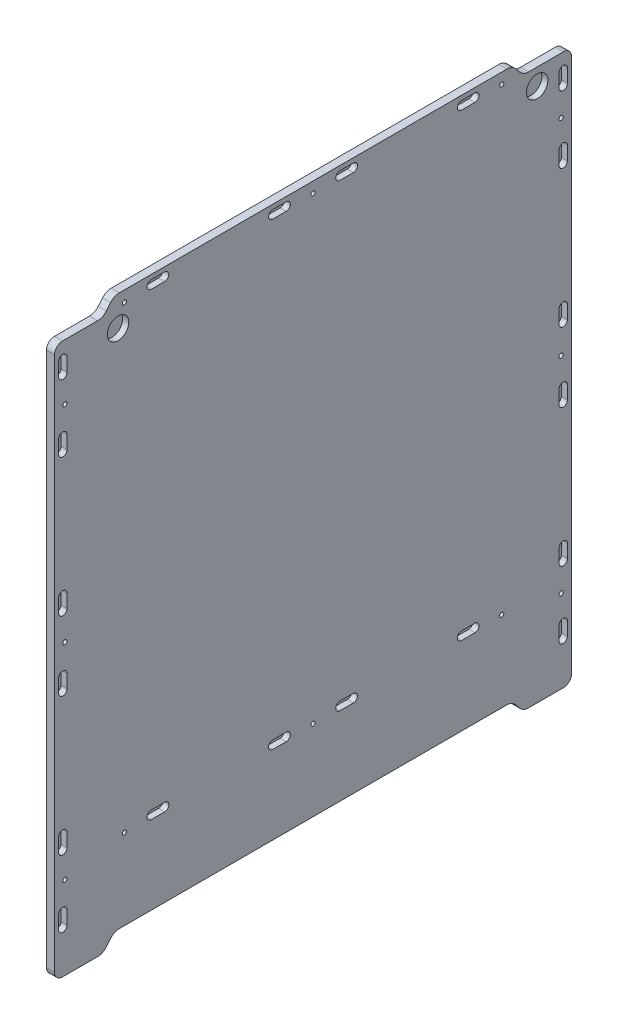
from build123d import *

# Parameters (mm, degrees)
CROQUIS1_R              = 4.25
CROQUIS1_R_2            = 1.55
CROQUIS1_R_3            = 1.6
SALIENTE_EXTRUIR1_DEPTH = 6
CROQUIS3_R              = 8
CORTAR_EXTRUIR1_DEPTH   = 4.5
CHAFL_N1_SIZE           = 1.5
CROQUIS4_W              = 11.100184954
CROQUIS4_H              = 11.272280845
CROQUIS4_W_2            = 11.999327681
SALIENTE_EXTRUIR2_DEPTH = 1.5


with BuildPart() as part:
    # Croquis1 → Saliente-Extruir1 (new body)
    with BuildSketch(Plane(origin=(0, 0, 0), x_dir=(0, 0, -1), z_dir=(1, 0, 0))):
        with BuildLine():
            Line((138.549019323, -203.054493985), (135.2532588, -199.126759542))
            ThreePointArc((135.2532588, -199.126759542), (132.334136258, -196.886838034), (128.741881033, -196.090454224))
            Line((128.741881033, -196.090454224), (-159.54831728, -196.090454224))
            ThreePointArc((-159.54831728, -196.090454224), (-163.140572505, -196.886838034), (-166.059695047, -199.126759542))
            Line((-166.059695047, -199.126759542), (-169.355455569, -203.054493985))
            ThreePointArc((-169.355455569, -203.054493985), (-172.274578058, -205.294415452), (-175.866833217, -206.090799248))
            Line((-175.866833217, -206.090799248), (-201.903218123, -206.090799248))
            ThreePointArc((-201.903218123, -206.090799248), (-206.14585881, -204.333439935), (-207.903218123, -200.090799248))
            Line((-207.903218123, -200.090799248), (-207.903218123, 198.006904316))
            ThreePointArc((-207.903218123, 198.006904316), (-206.14585881, 202.249545003), (-201.903218123, 204.006904316))
            Line((-201.903218123, 204.006904316), (-175.90321816, 204.006904316))
            ThreePointArc((-175.90321816, 204.006904316), (-172.310962954, 204.803288122), (-169.391840427, 207.043209618))
            Line((-169.391840427, 207.043209618), (-166.178352388, 210.872895533))
            ThreePointArc((-166.178352388, 210.872895533), (-163.259229941, 213.112816968), (-159.666974833, 213.909200752))
            Line((-159.666974833, 213.909200752), (128.860538587, 213.909200752))
            ThreePointArc((128.860538587, 213.909200752), (132.452793695, 213.112816968), (135.371916141, 210.872895533))
            Line((135.371916141, 210.872895533), (138.585404181, 207.043209618))
            ThreePointArc((138.585404181, 207.043209618), (141.504526707, 204.803288122), (145.096781914, 204.006904316))
            Line((145.096781914, 204.006904316), (171.096781877, 204.006904316))
            ThreePointArc((171.096781877, 204.006904316), (175.339422564, 202.249545003), (177.096781877, 198.006904316))
            Line((177.096781877, 198.006904316), (177.096781877, -200.090799248))
            ThreePointArc((177.096781877, -200.090799248), (175.339422564, -204.333439935), (171.096781877, -206.090799248))
            Line((171.096781877, -206.090799248), (145.060396971, -206.090799248))
            ThreePointArc((145.060396971, -206.090799248), (141.468141811, -205.294415452), (138.549019323, -203.054493985))
        make_face()
        with Locations((151.496781877, 191.506904316)):
            Circle(CROQUIS1_R, mode=Mode.SUBTRACT)
        with Locations((-160.603218123, 191.506904316)):
            Circle(CROQUIS1_R, mode=Mode.SUBTRACT)
        with Locations((-15.403218123, 205.909200752)):
            Circle(CROQUIS1_R_2, mode=Mode.SUBTRACT)
        with Locations((125.096781877, 205.909200752)):
            Circle(CROQUIS1_R_2, mode=Mode.SUBTRACT)
        with Locations((-155.903218123, 205.909200752)):
            Circle(CROQUIS1_R_2, mode=Mode.SUBTRACT)
        with Locations((-15.403218123, -136.090799248)):
            Circle(CROQUIS1_R_2, mode=Mode.SUBTRACT)
        with Locations((125.096781877, -136.090799248)):
            Circle(CROQUIS1_R_2, mode=Mode.SUBTRACT)
        with Locations((-155.903218123, -136.090799248)):
            Circle(CROQUIS1_R_2, mode=Mode.SUBTRACT)
        with Locations((-200.153218123, 162.206904316)):
            Circle(CROQUIS1_R_3, mode=Mode.SUBTRACT)
        with Locations((-200.153218123, 8.909373264)):
            Circle(CROQUIS1_R_3, mode=Mode.SUBTRACT)
        with Locations(Location((-200.153218123, -144.388157788, 0), (0, 0, 180))):
            Circle(CROQUIS1_R_3, mode=Mode.SUBTRACT)
        with Locations((169.346781877, -144.388157788)):
            Circle(CROQUIS1_R_3, mode=Mode.SUBTRACT)
        with Locations(Location((169.346781877, 8.909373264, 0), (0, 0, 180))):
            Circle(CROQUIS1_R_3, mode=Mode.SUBTRACT)
        with Locations(Location((169.346781877, 162.206904316, 0), (0, 0, 180))):
            Circle(CROQUIS1_R_3, mode=Mode.SUBTRACT)
    extrude(amount=SALIENTE_EXTRUIR1_DEPTH)

    # Croquis3 → Cortar-Extruir1 (cut)
    with BuildSketch(Plane(origin=(6, 0, 0), x_dir=(0, 0, -1), z_dir=(1, 0, 0))):
        with Locations((-160.603218123, 191.506904316)):
            Circle(CROQUIS3_R)
        with Locations((151.496781877, 191.506904316)):
            Circle(CROQUIS3_R)
        with BuildLine():
            Line((-198.603218123, 192.206904316), (-198.603218123, 182.206904316))
            ThreePointArc((-198.603218123, 182.206904316), (-201.703218123, 179.106904316), (-204.803218123, 182.206904316))
            Line((-204.803218123, 182.206904316), (-204.803218123, 192.206904316))
            ThreePointArc((-204.803218123, 192.206904316), (-201.703218123, 195.306904316), (-198.603218123, 192.206904316))
        make_face()
        with BuildLine():
            Line((-198.603218123, 142.206904316), (-198.603218123, 132.206904316))
            ThreePointArc((-198.603218123, 132.206904316), (-201.703218123, 129.106904316), (-204.803218123, 132.206904316))
            Line((-204.803218123, 132.206904316), (-204.803218123, 142.206904316))
            ThreePointArc((-204.803218123, 142.206904316), (-201.703218123, 145.306904316), (-198.603218123, 142.206904316))
        make_face()
        with BuildLine():
            Line((-198.603218123, -124.388157788), (-198.603218123, -114.388157788))
            ThreePointArc((-198.603218123, -114.388157788), (-201.703218123, -111.288157788), (-204.803218123, -114.388157788))
            Line((-204.803218123, -114.388157788), (-204.803218123, -124.388157788))
            ThreePointArc((-204.803218123, -124.388157788), (-201.703218123, -127.488157788), (-198.603218123, -124.388157788))
        make_face()
        with BuildLine():
            Line((-204.803218123, -174.388157788), (-204.803218123, -164.388157788))
            ThreePointArc((-204.803218123, -164.388157788), (-201.703218123, -161.288157788), (-198.603218123, -164.388157788))
            Line((-198.603218123, -164.388157788), (-198.603218123, -174.388157788))
            ThreePointArc((-198.603218123, -174.388157788), (-201.703218123, -177.488157788), (-204.803218123, -174.388157788))
        make_face()
        with BuildLine():
            Line((-198.603218123, 39.767139749), (-198.603218123, 29.767139749))
            ThreePointArc((-198.603218123, 29.767139749), (-201.703218123, 26.667139749), (-204.803218123, 29.767139749))
            Line((-204.803218123, 29.767139749), (-204.803218123, 39.767139749))
            ThreePointArc((-204.803218123, 39.767139749), (-201.703218123, 42.867139749), (-198.603218123, 39.767139749))
        make_face()
        with BuildLine():
            Line((-198.603218123, -11.94839322), (-198.603218123, -21.94839322))
            ThreePointArc((-198.603218123, -21.94839322), (-201.703218123, -25.04839322), (-204.803218123, -21.94839322))
            Line((-204.803218123, -21.94839322), (-204.803218123, -11.94839322))
            ThreePointArc((-204.803218123, -11.94839322), (-201.703218123, -8.84839322), (-198.603218123, -11.94839322))
        make_face()
        with BuildLine():
            Line((167.796781877, -174.388157788), (167.796781877, -164.388157788))
            ThreePointArc((167.796781877, -164.388157788), (170.896781877, -161.288157788), (173.996781877, -164.388157788))
            Line((173.996781877, -164.388157788), (173.996781877, -174.388157788))
            ThreePointArc((173.996781877, -174.388157788), (170.896781877, -177.488157788), (167.796781877, -174.388157788))
        make_face()
        with BuildLine():
            Line((173.996781877, -124.388157788), (173.996781877, -114.388157788))
            ThreePointArc((173.996781877, -114.388157788), (170.896781877, -111.288157788), (167.796781877, -114.388157788))
            Line((167.796781877, -114.388157788), (167.796781877, -124.388157788))
            ThreePointArc((167.796781877, -124.388157788), (170.896781877, -127.488157788), (173.996781877, -124.388157788))
        make_face()
        with BuildLine():
            Line((173.996781877, -11.94839322), (173.996781877, -21.94839322))
            ThreePointArc((173.996781877, -21.94839322), (170.896781877, -25.04839322), (167.796781877, -21.94839322))
            Line((167.796781877, -21.94839322), (167.796781877, -11.94839322))
            ThreePointArc((167.796781877, -11.94839322), (170.896781877, -8.84839322), (173.996781877, -11.94839322))
        make_face()
        with BuildLine():
            Line((173.996781877, 39.767139749), (173.996781877, 29.767139749))
            ThreePointArc((173.996781877, 29.767139749), (170.896781877, 26.667139749), (167.796781877, 29.767139749))
            Line((167.796781877, 29.767139749), (167.796781877, 39.767139749))
            ThreePointArc((167.796781877, 39.767139749), (170.896781877, 42.867139749), (173.996781877, 39.767139749))
        make_face()
        with BuildLine():
            Line((-45.403218123, 210.509200752), (-35.403218123, 210.509200752))
            ThreePointArc((-35.403218123, 210.509200752), (-32.303218123, 207.409200752), (-35.403218123, 204.309200752))
            Line((-35.403218123, 204.309200752), (-45.403218123, 204.309200752))
            ThreePointArc((-45.403218123, 204.309200752), (-48.503218123, 207.409200752), (-45.403218123, 210.509200752))
        make_face()
        with BuildLine():
            Line((-135.903218123, 210.509200752), (-125.903218123, 210.509200752))
            ThreePointArc((-125.903218123, 210.509200752), (-122.803218123, 207.409200752), (-125.903218123, 204.309200752))
            Line((-125.903218123, 204.309200752), (-135.903218123, 204.309200752))
            ThreePointArc((-135.903218123, 204.309200752), (-139.003218123, 207.409200752), (-135.903218123, 210.509200752))
        make_face()
        with BuildLine():
            Line((105.096781877, 204.309200752), (95.096781877, 204.309200752))
            ThreePointArc((95.096781877, 204.309200752), (91.996781877, 207.409200752), (95.096781877, 210.509200752))
            Line((95.096781877, 210.509200752), (105.096781877, 210.509200752))
            ThreePointArc((105.096781877, 210.509200752), (108.196781877, 207.409200752), (105.096781877, 204.309200752))
        make_face()
        with BuildLine():
            Line((14.596781877, 204.309200752), (4.596781877, 204.309200752))
            ThreePointArc((4.596781877, 204.309200752), (1.496781877, 207.409200752), (4.596781877, 210.509200752))
            Line((4.596781877, 210.509200752), (14.596781877, 210.509200752))
            ThreePointArc((14.596781877, 210.509200752), (17.696781877, 207.409200752), (14.596781877, 204.309200752))
        make_face()
        with BuildLine():
            Line((-135.903218123, -131.490799248), (-125.903218123, -131.490799248))
            ThreePointArc((-125.903218123, -131.490799248), (-122.803218123, -134.590799248), (-125.903218123, -137.690799248))
            Line((-125.903218123, -137.690799248), (-135.903218123, -137.690799248))
            ThreePointArc((-135.903218123, -137.690799248), (-139.003218123, -134.590799248), (-135.903218123, -131.490799248))
        make_face()
        with BuildLine():
            Line((-45.403218123, -131.490799248), (-35.403218123, -131.490799248))
            ThreePointArc((-35.403218123, -131.490799248), (-32.303218123, -134.590799248), (-35.403218123, -137.690799248))
            Line((-35.403218123, -137.690799248), (-45.403218123, -137.690799248))
            ThreePointArc((-45.403218123, -137.690799248), (-48.503218123, -134.590799248), (-45.403218123, -131.490799248))
        make_face()
        with BuildLine():
            Line((14.596781877, -131.490799248), (4.596781877, -131.490799248))
            ThreePointArc((4.596781877, -131.490799248), (1.496781877, -134.590799248), (4.596781877, -137.690799248))
            Line((4.596781877, -137.690799248), (14.596781877, -137.690799248))
            ThreePointArc((14.596781877, -137.690799248), (17.696781877, -134.590799248), (14.596781877, -131.490799248))
        make_face()
        with BuildLine():
            Line((105.096781877, -131.490799248), (95.096781877, -131.490799248))
            ThreePointArc((95.096781877, -131.490799248), (91.996781877, -134.590799248), (95.096781877, -137.690799248))
            Line((95.096781877, -137.690799248), (105.096781877, -137.690799248))
            ThreePointArc((105.096781877, -137.690799248), (108.196781877, -134.590799248), (105.096781877, -131.490799248))
        make_face()
        with BuildLine():
            Line((173.996781877, 142.206904316), (173.996781877, 132.206904316))
            ThreePointArc((173.996781877, 132.206904316), (170.896781877, 129.106904316), (167.796781877, 132.206904316))
            Line((167.796781877, 132.206904316), (167.796781877, 142.206904316))
            ThreePointArc((167.796781877, 142.206904316), (170.896781877, 145.306904316), (173.996781877, 142.206904316))
        make_face()
        with BuildLine():
            Line((173.996781877, 192.206904316), (173.996781877, 182.206904316))
            ThreePointArc((173.996781877, 182.206904316), (170.896781877, 179.106904316), (167.796781877, 182.206904316))
            Line((167.796781877, 182.206904316), (167.796781877, 192.206904316))
            ThreePointArc((167.796781877, 192.206904316), (170.896781877, 195.306904316), (173.996781877, 192.206904316))
        make_face()
    extrude(amount=-CORTAR_EXTRUIR1_DEPTH, mode=Mode.SUBTRACT)

    # Chaflán1
    chafl_n1_edges = [part.edges().sort_by_distance(p)[0] for p in [
        (0, 8.909373264, -170.946781877),
        (0, 162.206904316, -170.946781877),
        (0, 205.909200752, 16.953218123),
        (0, 205.909200752, -123.546781877),
        (0, 205.909200752, 157.453218123),
        (0, -136.090799248, 16.953218123),
        (0, -136.090799248, -123.546781877),
        (0, -136.090799248, 157.453218123),
        (0, 162.206904316, 201.753218123),
        (0, 8.909373264, 201.753218123),
        (0, -144.388157788, 198.553218123),
        (0, -144.388157788, -167.746781877),
    ]]
    chamfer(chafl_n1_edges, length=CHAFL_N1_SIZE)

    # Croquis4 → Saliente-Extruir2 (add)
    with BuildSketch(Plane.ZY):
        with Locations((-151.595226522, 191.649895838)):
            Rectangle(CROQUIS4_W, CROQUIS4_H)
        with Locations((160.735035587, 191.649895838)):
            Rectangle(CROQUIS4_W_2, CROQUIS4_H)
    extrude(amount=-SALIENTE_EXTRUIR2_DEPTH)


solid = part.part
